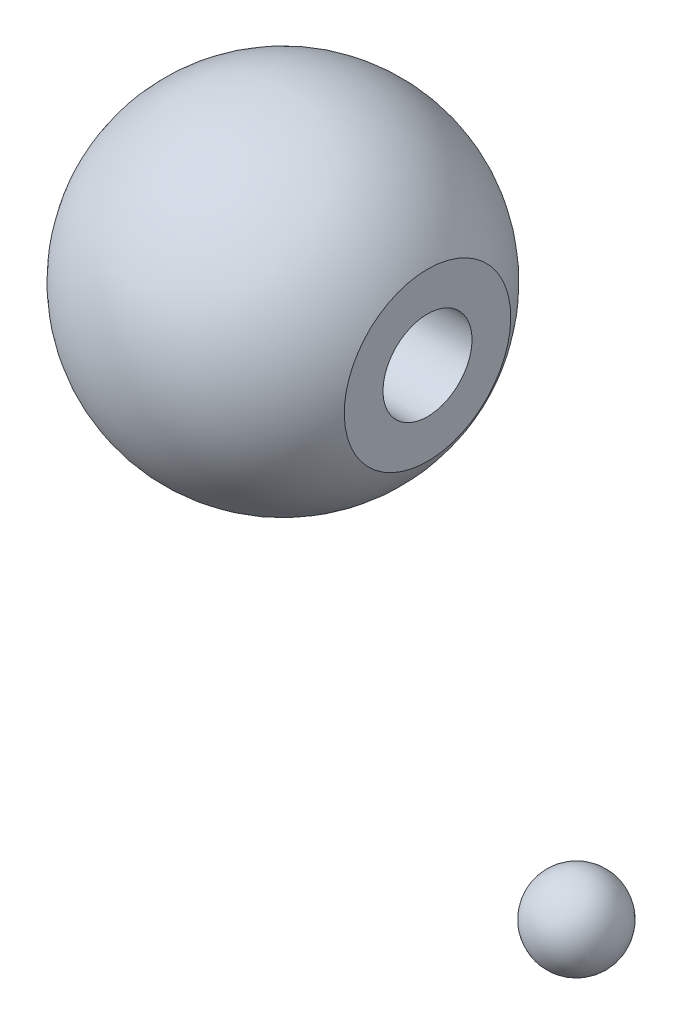
from build123d import *

# Parameters (mm, degrees)
M12X1_5_TAPPED_HOLE1_D     = 12
M12X1_5_TAPPED_HOLE1_DEPTH = 34
M12X1_5_TAPPED_HOLE1_TIP   = 3.605163714


with BuildPart() as part:
    # Sketch1 → Revolve1 (revolve)
    with BuildSketch(Plane.XY, mode=Mode.PRIVATE) as revolve1_sk:
        with BuildLine():
            Line((19.5, 0), (-22.5, 0))
            ThreePointArc((-22.5, 0), (-5.809475019, -21.737065119), (19.5, -11.22497216))
            Line((19.5, -11.22497216), (19.5, 0))
        make_face()
    revolve(revolve1_sk.sketch.rotate(Axis((19.5, 0, 0), (-1, 0, 0)), 180), axis=Axis((19.5, 0, 0), (-1, 0, 0)))

    # M12x1.5 Tapped Hole1
    with Locations(Plane.YZ.offset(19.5)):
        with Locations((0, 0)):
            Hole(M12X1_5_TAPPED_HOLE1_D / 2, depth=M12X1_5_TAPPED_HOLE1_DEPTH)
            with Locations((0, 0, -(M12X1_5_TAPPED_HOLE1_DEPTH + M12X1_5_TAPPED_HOLE1_TIP / 2))):  # 118° drill point
                Cone(0, M12X1_5_TAPPED_HOLE1_D / 2, M12X1_5_TAPPED_HOLE1_TIP, mode=Mode.SUBTRACT)


with BuildPart() as body_2:
    # Sketch4 → Revolve2 (revolve)
    with BuildSketch(Plane(origin=(0, 0, 0), x_dir=(1, 0, 0), z_dir=(0, 1, 0))):
        with BuildLine():
            Line((94.24475553, -49.072993289), (94.24475553, -60.272993289))
            ThreePointArc((94.24475553, -60.272993289), (99.84475553, -54.672993289), (94.24475553, -49.072993289))
        make_face()
    revolve(axis=Axis((94.24475553, 0, 49.072993289), (0, 0, 1)))


solid = Compound([part.part, body_2.part])
